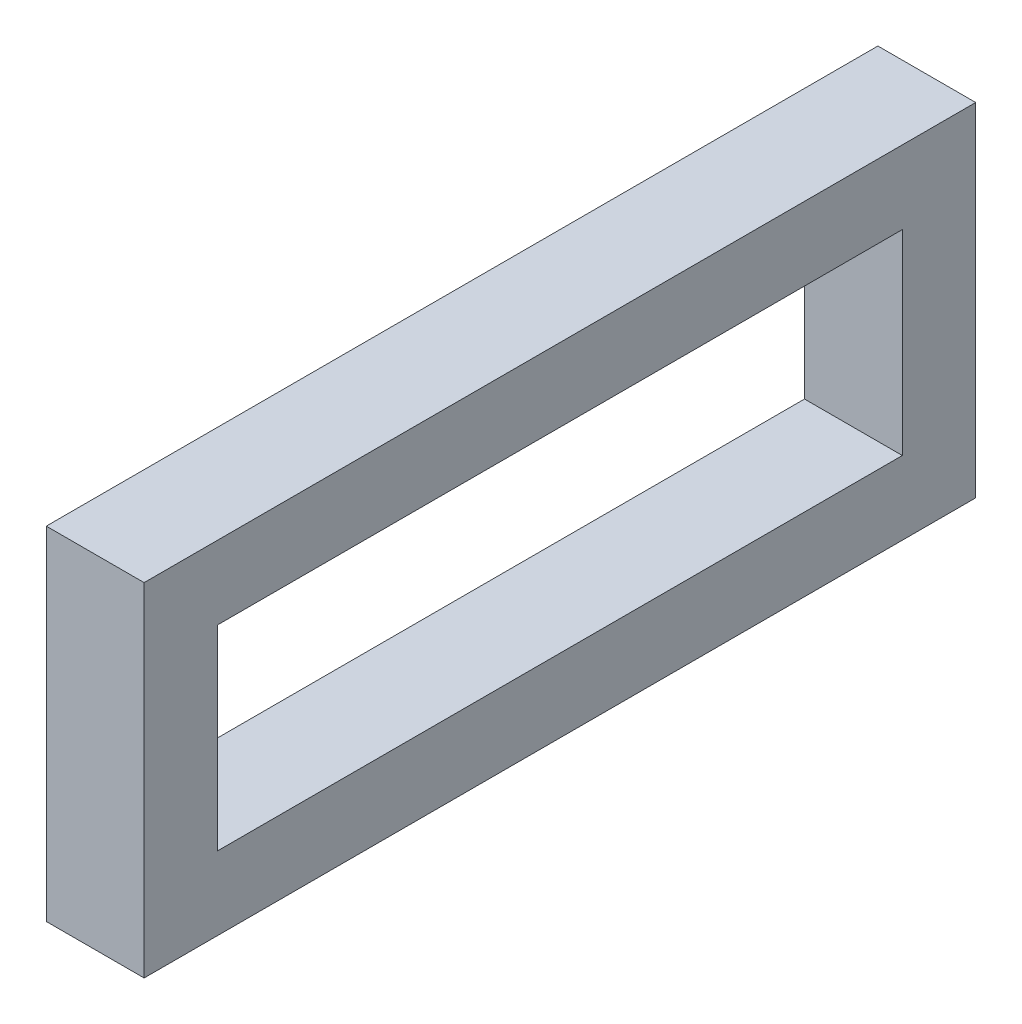
from build123d import *

# Parameters (mm, degrees)
SKETCH2_W           = 170
SKETCH2_H           = 70
SKETCH2_W_2         = 140
SKETCH2_H_2         = 40
BOSS_EXTRUDE1_DEPTH = 20


with BuildPart() as part:
    # Sketch2 → Boss-Extrude1 (new body)
    with BuildSketch(Plane(origin=(0, 0, 0), x_dir=(0, 0, -1), z_dir=(1, 0, 0))):
        Rectangle(SKETCH2_W, SKETCH2_H)
        Rectangle(SKETCH2_W_2, SKETCH2_H_2, mode=Mode.SUBTRACT)
    extrude(amount=BOSS_EXTRUDE1_DEPTH)


solid = part.part
